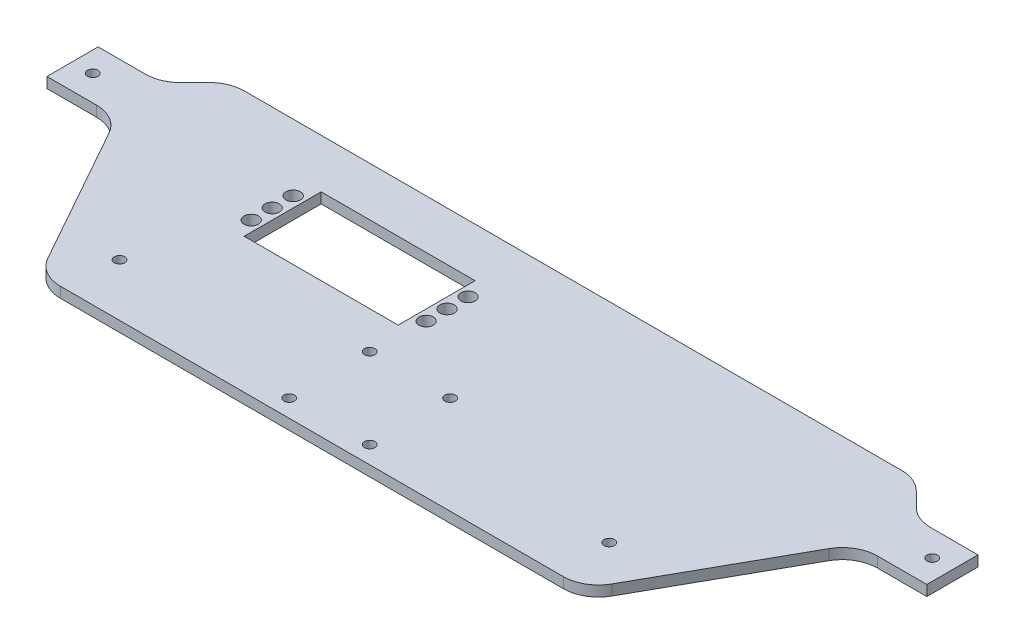
from build123d import *

# Parameters (mm, degrees)
SALIENTE_EXTRUIR1_DEPTH = 3
REDONDEO1_R             = 10
CROQUIS2_R              = 1.5
CROQUIS2_R_2            = 2.05
CROQUIS2_W              = 42
CROQUIS2_H              = 20
CORTAR_EXTRUIR1_DEPTH   = 135.610141171
CROQUIS3_W              = 4
CROQUIS3_H              = 14.636342218
CORTAR_EXTRUIR2_DEPTH   = 135.610141171
CROQUIS4_W              = 44
CROQUIS4_H              = 22
CORTAR_EXTRUIR3_DEPTH   = 131.820067673
CORTAR_EXTRUIR4_DEPTH   = 131.820067673
REDONDEO2_R             = 20
CORTAR_EXTRUIR5_DEPTH   = 10
REDONDEO3_R             = 10
CROQUIS7_W              = 14.636342218
CROQUIS7_H              = 3
SALIENTE_EXTRUIR2_DEPTH = 2
CROQUIS8_W              = 14.636342218
CROQUIS8_H              = 3
SALIENTE_EXTRUIR3_DEPTH = 2


with BuildPart() as part:
    # Croquis1 → Saliente-Extruir1 (new body)
    with BuildSketch(Plane(origin=(0, 0, 0), x_dir=(1, 0, 0), z_dir=(0, 1, 0))):
        Polygon((-88.1, 42.318171109), (88.1, 42.318171109), (108.1, 22.318171109), (127.75, 22.318171109), (127.75, 7.681828891), (105.75, 7.681828891), (77.75, -42.318171109), (-77.75, -42.318171109), (-105.75, 7.681828891), (-127.75, 7.681828891), (-127.75, 22.318171109), (-108.1, 22.318171109), align=None)
    extrude(amount=SALIENTE_EXTRUIR1_DEPTH)

    # Redondeo1
    redondeo1_edges = [part.edges().sort_by_distance(p)[0] for p in [
        (-88.1, 1.5, -42.318171109),
        (88.1, 1.5, -42.318171109),
        (108.1, 1.5, -22.318171109),
        (105.75, 1.5, -7.681828891),
        (77.75, 1.5, 42.318171109),
        (-77.75, 1.5, 42.318171109),
        (-105.75, 1.5, -7.681828891),
        (-108.1, 1.5, -22.318171109),
    ]]
    fillet(redondeo1_edges, radius=REDONDEO1_R)

    # Croquis2 → Cortar-Extruir1 (cut, through all)
    with BuildSketch(Plane(origin=(0, 3, 0), x_dir=(1, 0, 0), z_dir=(0, 1, 0))):
        with Locations(Location((70, -27.318171109, 0), (0, 0, 270))):
            Circle(CROQUIS2_R)
        with Locations(Location((-70, -27.318171109, 0), (0, 0, 270))):
            Circle(CROQUIS2_R)
        with Locations(Location((-119.996067812, 15, 0), (0, 0, 270))):
            Circle(CROQUIS2_R)
        with Locations(Location((119.996067812, 15, 0), (0, 0, 270))):
            Circle(CROQUIS2_R)
        with Locations(Location((-11.5, -14.318171109, 0), (0, 0, 270))):
            Circle(CROQUIS2_R)
        with Locations(Location((11.5, -14.318171109, 0), (0, 0, 270))):
            Circle(CROQUIS2_R)
        with Locations(Location((-11.5, -37.318171109, 0), (0, 0, 270))):
            Circle(CROQUIS2_R)
        with Locations(Location((11.5, -37.318171109, 0), (0, 0, 270))):
            Circle(CROQUIS2_R)
        with Locations(Location((-61, 7.318171109, 0), (0, 0, 270))):
            Circle(CROQUIS2_R_2)
        with Locations(Location((-11, 7.318171109, 0), (0, 0, 270))):
            Circle(CROQUIS2_R_2)
        with Locations(Location((-61, 13.318171109, 0), (0, 0, 270))):
            Circle(CROQUIS2_R_2)
        with Locations(Location((-61, 1.318171109, 0), (0, 0, 270))):
            Circle(CROQUIS2_R_2)
        with Locations(Location((-11, 13.318171109, 0), (0, 0, 270))):
            Circle(CROQUIS2_R_2)
        with Locations(Location((-11, 1.318171109, 0), (0, 0, 270))):
            Circle(CROQUIS2_R_2)
        with Locations((-36, 7.318171109)):
            Rectangle(CROQUIS2_W, CROQUIS2_H)
    extrude(amount=-CORTAR_EXTRUIR1_DEPTH, mode=Mode.SUBTRACT)

    # Croquis3 → Cortar-Extruir2 (cut, through all)
    with BuildSketch(Plane(origin=(0, 3, 0), x_dir=(1, 0, 0), z_dir=(0, 1, 0))):
        with Locations((-125.75, 15)):
            Rectangle(CROQUIS3_W, CROQUIS3_H)
        with Locations((125.75, 15)):
            Rectangle(CROQUIS3_W, CROQUIS3_H)
    extrude(amount=-CORTAR_EXTRUIR2_DEPTH, mode=Mode.SUBTRACT)

    # Croquis4 → Cortar-Extruir3 (cut, through all)
    with BuildSketch(Plane(origin=(0, 3, 0), x_dir=(1, 0, 0), z_dir=(0, 1, 0))):
        with Locations((-36, 7.318171109)):
            Rectangle(CROQUIS4_W, CROQUIS4_H)
    extrude(amount=-CORTAR_EXTRUIR3_DEPTH, mode=Mode.SUBTRACT)

    # Croquis5 → Cortar-Extruir4 (cut, through all)
    with BuildSketch(Plane(origin=(0, 3, 0), x_dir=(1, 0, 0), z_dir=(0, 1, 0))):
        Polygon((-63.75, 42.318171109), (-38.75, 32.318171109), (38.75, 32.318171109), (63.75, 42.318171109), align=None)
    extrude(amount=-CORTAR_EXTRUIR4_DEPTH, mode=Mode.SUBTRACT)

    # Redondeo2
    redondeo2_edges = [part.edges().sort_by_distance(p)[0] for p in [
        (-63.75, 1.5, -42.318171109),
        (63.75, 1.5, -42.318171109),
        (38.75, 1.5, -32.318171109),
        (-38.75, 1.5, -32.318171109),
    ]]
    fillet(redondeo2_edges, radius=REDONDEO2_R)

    # Croquis6 → Cortar-Extruir5 (cut)
    with BuildSketch(Plane(origin=(0, 3, 0), x_dir=(1, 0, 0), z_dir=(0, 1, 0))):
        Polygon((-34.898351929, 32.318171109), (-98.1, 32.318171109), (-98.1, 50.604425951), (105.42793471, 50.604425951), (105.42793471, 32.318171109), align=None)
    extrude(amount=-CORTAR_EXTRUIR5_DEPTH, mode=Mode.SUBTRACT)

    # Redondeo3
    redondeo3_edges = [part.edges().sort_by_distance(p)[0] for p in [
        (98.1, 1.5, -32.318171109),
        (-98.1, 1.5, -32.318171109),
    ]]
    fillet(redondeo3_edges, radius=REDONDEO3_R)

    # Croquis7 → Saliente-Extruir2 (add)
    with BuildSketch(Plane.ZY.offset(123.75)):
        with Locations((-15, 1.5)):
            Rectangle(CROQUIS7_W, CROQUIS7_H)
    extrude(amount=SALIENTE_EXTRUIR2_DEPTH)

    # Croquis8 → Saliente-Extruir3 (add)
    with BuildSketch(Plane(origin=(123.75, 0, 0), x_dir=(0, 0, -1), z_dir=(1, 0, 0))):
        with Locations((15, 1.5)):
            Rectangle(CROQUIS8_W, CROQUIS8_H)
    extrude(amount=SALIENTE_EXTRUIR3_DEPTH)


solid = part.part
